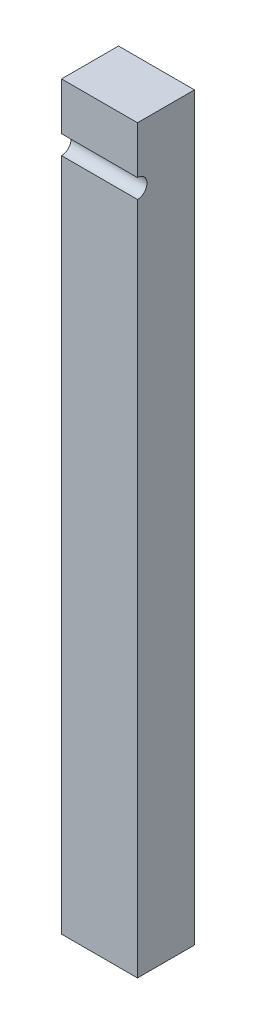
from build123d import *

# Parameters (mm, degrees)
SKETCH1_W           = 101.6
SKETCH1_H           = 76.2
BOSS_EXTRUDE1_DEPTH = 990.6
SKETCH2_R           = 12.7
CUT_EXTRUDE1_DEPTH  = 999.707845168


with BuildPart() as part:
    # Sketch1 → Boss-Extrude1 (new body)
    with BuildSketch(Plane(origin=(0, 0, 0), x_dir=(1, 0, 0), z_dir=(0, 1, 0))):
        with Locations((50.8, 38.1)):
            Rectangle(SKETCH1_W, SKETCH1_H)
    extrude(amount=BOSS_EXTRUDE1_DEPTH)

    # Sketch2 → Cut-Extrude1 (cut, through all)
    with BuildSketch(Plane(origin=(101.6, 0, 0), x_dir=(0, 0, -1), z_dir=(1, 0, 0))):
        with Locations((0, 914.4)):
            Circle(SKETCH2_R)
    extrude(amount=-CUT_EXTRUDE1_DEPTH, mode=Mode.SUBTRACT)


solid = part.part
